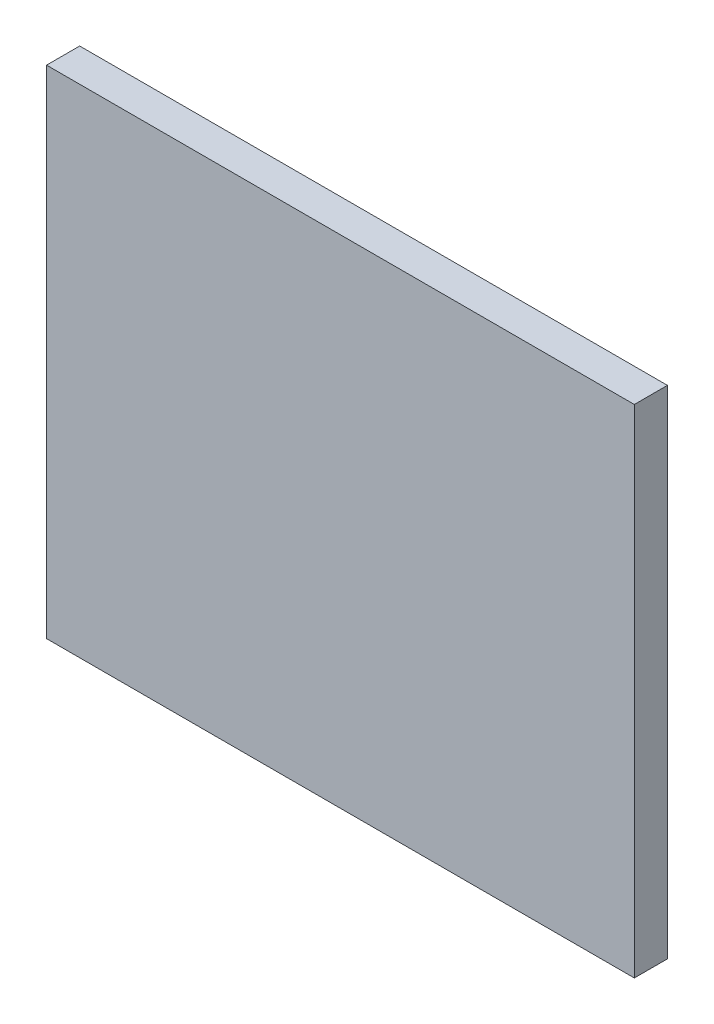
from build123d import *

# Parameters (mm, degrees)
SKETCH1_W           = 71
SKETCH1_H           = 4
BOSS_EXTRUDE1_DEPTH = 60


with BuildPart() as part:
    # Sketch1 → Boss-Extrude1 (new body)
    with BuildSketch(Plane(origin=(0, 0, 0), x_dir=(1, 0, 0), z_dir=(0, 1, 0))):
        with Locations((35.5, 2)):
            Rectangle(SKETCH1_W, SKETCH1_H)
    extrude(amount=BOSS_EXTRUDE1_DEPTH)


solid = part.part
